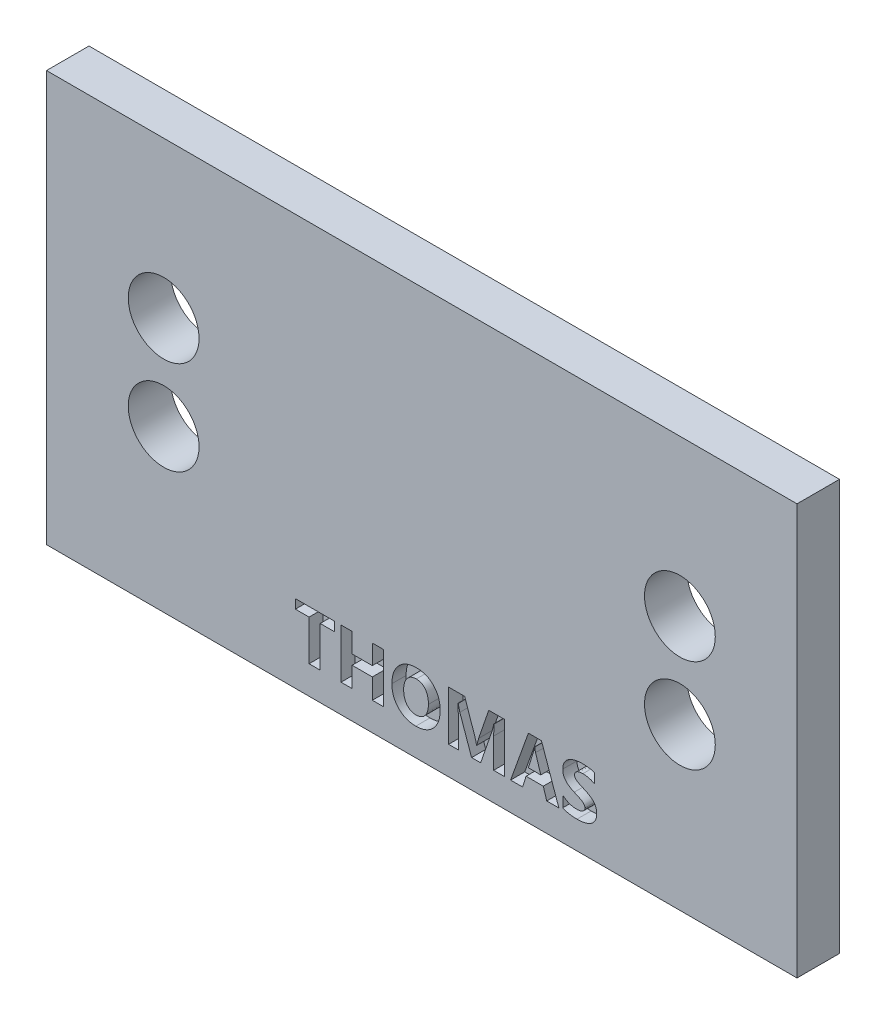
from build123d import *

# Parameters (mm, degrees)
SKETCH1_W           = 53
SKETCH1_H           = 29
SKETCH1_R           = 2.5
BOSS_EXTRUDE1_DEPTH = 3
CUT_EXTRUDE1_DEPTH  = 1


with BuildPart() as part:
    # Sketch1 → Boss-Extrude1 (new body)
    with BuildSketch(Plane.XY):
        with Locations((0.842105263, 3.907894737)):
            Rectangle(SKETCH1_W, SKETCH1_H)
        with Locations((-17.386708014, 0.781282568)):
            Circle(SKETCH1_R, mode=Mode.SUBTRACT)
        with Locations((19.07091854, 0.781282568)):
            Circle(SKETCH1_R, mode=Mode.SUBTRACT)
        with Locations((19.07091854, 7.39994378)):
            Circle(SKETCH1_R, mode=Mode.SUBTRACT)
        with Locations((-17.386708014, 7.39994378)):
            Circle(SKETCH1_R, mode=Mode.SUBTRACT)
    extrude(amount=BOSS_EXTRUDE1_DEPTH)

    # Sketch2 → Cut-Extrude1 (cut)
    # profile 1 of 6: a face of its own
    with BuildSketch(Plane.XY.offset(3)):
        Polygon((-5.319115808, -5.746417775), (-6.332273703, -5.746417775), (-6.332273703, -8.601680933), (-7.115168439, -8.601680933), (-7.115168439, -5.746417775), (-8.082273703, -5.746417775), (-8.082273703, -5.101680933), (-5.319115808, -5.101680933), align=None)
    # profile 2 of 6: a face of its own
    with BuildSketch(Plane.XY.offset(3)):
        Polygon((-1.865168439, -8.601680933), (-2.648063176, -8.601680933), (-2.648063176, -7.174049354), (-4.075694755, -7.174049354), (-4.075694755, -8.601680933), (-4.858589492, -8.601680933), (-4.858589492, -5.101680933), (-4.075694755, -5.101680933), (-4.075694755, -6.483259881), (-2.648063176, -6.483259881), (-2.648063176, -5.101680933), (-1.865168439, -5.101680933), align=None)
    # profile 3 of 6: a face of its own
    with BuildSketch(Plane.XY.offset(3)):
        with BuildLine():
            add(Edge.make_bspline(
                [(0.421632547, -8.647733565), (0.360886152, -8.646127526), (0.241615003, -8.642974184), (0.067023663, -8.620745981), (-0.098949007, -8.582301478), (-0.256377446, -8.529321102), (-0.405020681, -8.460194729), (-0.545247851, -8.376740139), (-0.676208606, -8.276960612), (-0.798044084, -8.164008411), (-0.907900315, -8.038259144), (-1.004077569, -7.902268276), (-1.085969089, -7.757357636), (-1.151419799, -7.602330998), (-1.203551471, -7.438874393), (-1.239637133, -7.265978025), (-1.26284714, -7.084255757), (-1.265252857, -6.95993058), (-1.266484229, -6.89629442)],
                knots=[0, 0, 0, 0, 1.066514654, 2.094024304, 3.083949431, 4.053508208, 5.005063613, 5.95701037, 6.91302883, 7.890458477, 8.869429341, 9.839289914, 10.810402398, 11.785888464, 12.788834388, 13.818042923, 14.883159698, 16, 16, 16, 16], degree=3))
            add(Edge.make_bspline(
                [(-1.266484229, -6.89629442), (-1.265325425, -6.829294159), (-1.263054559, -6.697996229), (-1.238720902, -6.506349998), (-1.203234551, -6.323909151), (-1.150022465, -6.15209708), (-1.083310731, -5.989423165), (-0.999864157, -5.837568223), (-0.903071333, -5.694259458), (-0.790980552, -5.562694929), (-0.667252401, -5.443270124), (-0.532090204, -5.339656641), (-0.38788856, -5.251214118), (-0.233083452, -5.179911813), (-0.069288599, -5.123321995), (0.104722888, -5.084224051), (0.288060636, -5.059912521), (0.413639198, -5.05707641), (0.477759192, -5.055628302)],
                knots=[0, 0, 0, 0, 1.12554662, 2.205692039, 3.242259702, 4.245908483, 5.223734231, 6.19255057, 7.153102442, 8.125652901, 9.092277335, 10.038164733, 10.982667815, 11.929628597, 12.897328609, 13.890001992, 14.922642057, 16, 16, 16, 16], degree=3))
            add(Edge.make_bspline(
                [(0.477759192, -5.055628302), (0.538269248, -5.057216206), (0.656831398, -5.060327513), (0.830427184, -5.082742396), (0.995095439, -5.120772594), (1.150889799, -5.174309003), (1.298085862, -5.24282753), (1.435771908, -5.327589542), (1.565095128, -5.426877476), (1.683815932, -5.541169482), (1.79147857, -5.667347075), (1.885962133, -5.803966703), (1.964218773, -5.951179804), (2.029558094, -6.10737389), (2.0797323, -6.273567252), (2.115518035, -6.449388484), (2.137499734, -6.634771144), (2.140088254, -6.761672743), (2.141410508, -6.8264959)],
                knots=[0, 0, 0, 0, 1.061845288, 2.080557679, 3.065951617, 4.023138676, 4.966648067, 5.909556233, 6.855120048, 7.822765862, 8.796245348, 9.761911246, 10.731870988, 11.716932167, 12.729003832, 13.77338215, 14.862611647, 16, 16, 16, 16], degree=3))
            add(Edge.make_bspline(
                [(2.141410508, -6.8264959), (2.140142413, -6.893001666), (2.137658224, -7.023285932), (2.114870103, -7.213733719), (2.077851157, -7.394467134), (2.025095928, -7.56501616), (1.9579965, -7.725946031), (1.875759037, -7.877081055), (1.777966564, -8.017908424), (1.666755644, -8.148058321), (1.543174421, -8.264843295), (1.410313979, -8.368014672), (1.267631946, -8.454860079), (1.115761844, -8.525528375), (0.954886186, -8.58063197), (0.785009001, -8.618851953), (0.606324556, -8.643520095), (0.484079455, -8.646308933), (0.421632547, -8.647733565)],
                knots=[0, 0, 0, 0, 1.132328248, 2.218222035, 3.261372295, 4.2705407, 5.253810636, 6.226363414, 7.195245697, 8.168733222, 9.136779753, 10.086262421, 11.028590864, 11.97529237, 12.933871248, 13.918904746, 14.936906574, 16, 16, 16, 16], degree=3))
        make_face()
        with BuildLine():
            add(Edge.make_bspline(
                [(0.455452449, -5.746417775), (0.422064183, -5.747452175), (0.356920275, -5.749470394), (0.261572057, -5.763315939), (0.171466628, -5.786520301), (0.087247935, -5.821425143), (0.007345116, -5.863382568), (-0.066363932, -5.916811102), (-0.135107556, -5.979082306), (-0.198204234, -6.050336465), (-0.254988103, -6.129346672), (-0.303951614, -6.215307194), (-0.34493723, -6.307276197), (-0.378990039, -6.405210374), (-0.405526058, -6.509437185), (-0.423775455, -6.619949033), (-0.435826853, -6.736282209), (-0.436957455, -6.815910426), (-0.43753686, -6.85671794)],
                knots=[0, 0, 0, 0, 0.999383284, 1.949898576, 2.878239443, 3.77697613, 4.673299942, 5.573985174, 6.494153057, 7.445291985, 8.417767725, 9.401943952, 10.401533592, 11.427998165, 12.502564195, 13.616962893, 14.77875175, 16, 16, 16, 16], degree=3))
            add(Edge.make_bspline(
                [(-0.43753686, -6.85671794), (-0.436953094, -6.898004561), (-0.435813684, -6.9785889), (-0.423862422, -7.095889582), (-0.405654467, -7.206673861), (-0.378708683, -7.310779085), (-0.345207156, -7.408651303), (-0.304299466, -7.500036935), (-0.254721498, -7.584215045), (-0.198442789, -7.661483716), (-0.135555699, -7.730763847), (-0.068156207, -7.791590067), (0.00480235, -7.84242681), (0.081949811, -7.884386705), (0.163844829, -7.917040734), (0.250364661, -7.939802499), (0.341463542, -7.955014474), (0.404059043, -7.956291809), (0.436023995, -7.956944091)],
                knots=[0, 0, 0, 0, 1.254202876, 2.447986969, 3.579160536, 4.662840844, 5.711642924, 6.719633901, 7.699699477, 8.675010393, 9.619324756, 10.538175985, 11.427887183, 12.314997099, 13.201537904, 14.09971778, 15.029603896, 16, 16, 16, 16], degree=3))
            add(Edge.make_bspline(
                [(0.436023995, -7.956944091), (0.468939859, -7.956237155), (0.533153868, -7.954858026), (0.626652303, -7.940536405), (0.715135639, -7.918619707), (0.798130875, -7.886723495), (0.876074621, -7.846194463), (0.94825222, -7.796022839), (1.015752954, -7.737320763), (1.07746634, -7.669654808), (1.132650016, -7.593988543), (1.181454741, -7.511576925), (1.221356344, -7.421438999), (1.255531008, -7.324902753), (1.281231486, -7.221001548), (1.298611905, -7.110220953), (1.310788926, -6.992985982), (1.311895961, -6.912397917), (1.31246314, -6.871109387)],
                knots=[0, 0, 0, 0, 1.00217265, 1.955091423, 2.875015528, 3.774864866, 4.657455052, 5.545354462, 6.446656772, 7.377747269, 8.329319954, 9.295679398, 10.29001399, 11.327793258, 12.4125512, 13.545522493, 14.742471758, 16, 16, 16, 16], degree=3))
            add(Edge.make_bspline(
                [(1.31246314, -6.871109387), (1.311821143, -6.827910676), (1.310574248, -6.74400943), (1.299523097, -6.621661875), (1.281883263, -6.50668607), (1.256969631, -6.399011902), (1.224082905, -6.29911971), (1.185941478, -6.205792911), (1.138690647, -6.120363106), (1.084612061, -6.042765167), (1.025429128, -5.972427702), (0.959065827, -5.91250202), (0.888403793, -5.860870146), (0.81206299, -5.818700326), (0.730292836, -5.786223097), (0.643259095, -5.76357151), (0.551211336, -5.748306973), (0.487897742, -5.747057879), (0.455452449, -5.746417775)],
                knots=[0, 0, 0, 0, 1.299402741, 2.523721339, 3.692309641, 4.796776925, 5.844208707, 6.853356801, 7.825499763, 8.774330453, 9.695566542, 10.584351255, 11.457621121, 12.323224798, 13.200925798, 14.09712034, 15.024862037, 16, 16, 16, 16], degree=3))
        make_face(mode=Mode.SUBTRACT)
    # profile 4 of 6: a face of its own
    with BuildSketch(Plane.XY.offset(3)):
        with BuildLine():
            Line((6.700621034, -8.601680933), (5.917726297, -8.601680933))
            Line((5.917726297, -8.601680933), (5.917726297, -6.507725341))
            add(Edge.make_bspline(
                [(5.917726297, -6.507725341), (5.918287461, -6.449677669), (5.919440111, -6.330445721), (5.92428941, -6.1473802), (5.933894902, -5.955480096), (5.942712734, -5.824838631), (5.947228765, -5.757930933)],
                knots=[0, 0, 0, 0, 0.928152517, 1.906457722, 2.927797591, 4, 4, 4, 4], degree=3))
            Line((5.947228765, -5.757930933), (5.927800311, -5.757930933))
            add(Edge.make_bspline(
                [(5.927800311, -5.757930933), (5.9227762, -5.783837815), (5.913095225, -5.833757864), (5.898862283, -5.906040397), (5.884412116, -5.97242132), (5.870876816, -6.033439534), (5.857055874, -6.088517926), (5.844415518, -6.138326531), (5.831399559, -6.182155536), (5.822553734, -6.209359011), (5.818425311, -6.222055111)],
                knots=[0, 0, 0, 0, 1.327313991, 2.557605269, 3.705207991, 4.744183751, 5.700973686, 6.5612476, 7.3285217, 8, 8, 8, 8], degree=3))
            Line((5.818425311, -6.222055111), (5.002430245, -8.601680933))
            Line((5.002430245, -8.601680933), (4.361291265, -8.601680933))
            Line((4.361291265, -8.601680933), (3.530904751, -6.246520571))
            add(Edge.make_bspline(
                [(3.530904751, -6.246520571), (3.527655467, -6.237205528), (3.520073404, -6.215469279), (3.510837371, -6.177472354), (3.498939143, -6.13032279), (3.486363864, -6.073858235), (3.471836353, -6.008168482), (3.456026026, -5.933085477), (3.438747313, -5.84870207), (3.427447233, -5.78912795), (3.421529751, -5.757930933)],
                knots=[0, 0, 0, 0, 0.472413095, 1.102355455, 1.871602873, 2.802702045, 3.873391322, 5.094959742, 6.47872549, 8, 8, 8, 8], degree=3))
            Line((3.421529751, -5.757930933), (3.39994258, -5.757930933))
            add(Edge.make_bspline(
                [(3.39994258, -5.757930933), (3.404775677, -5.841627693), (3.414120265, -6.003451825), (3.423194233, -6.238557279), (3.429362788, -6.457562642), (3.43039053, -6.598387737), (3.430884192, -6.666031262)],
                knots=[0, 0, 0, 0, 1.107032083, 2.140399523, 3.106764814, 4, 4, 4, 4], degree=3))
            Line((3.430884192, -6.666031262), (3.430884192, -8.601680933))
            Line((3.430884192, -8.601680933), (2.740094719, -8.601680933))
            Line((2.740094719, -8.601680933), (2.740094719, -5.101680933))
            Line((2.740094719, -5.101680933), (3.872701626, -5.101680933))
            Line((3.872701626, -5.101680933), (4.584358699, -7.176208071))
            add(Edge.make_bspline(
                [(4.584358699, -7.176208071), (4.59794709, -7.217583957), (4.625026831, -7.300040243), (4.658406474, -7.42526433), (4.686940623, -7.550502509), (4.701084581, -7.634499123), (4.708125146, -7.676310867)],
                knots=[0, 0, 0, 0, 1.012979573, 2.018724972, 3.013763031, 4, 4, 4, 4], degree=3))
            Line((4.708125146, -7.676310867), (4.722516594, -7.676310867))
            add(Edge.make_bspline(
                [(4.722516594, -7.676310867), (4.733248885, -7.629463461), (4.754063758, -7.538604695), (4.789224366, -7.407898795), (4.822925238, -7.285860951), (4.848388093, -7.208499628), (4.860674488, -7.171171065)],
                knots=[0, 0, 0, 0, 1.100720075, 2.134804773, 3.100001708, 4, 4, 4, 4], degree=3))
            Line((4.860674488, -7.171171065), (5.572331561, -5.101680933))
            Line((5.572331561, -5.101680933), (6.700621034, -5.101680933))
            Line((6.700621034, -5.101680933), (6.700621034, -8.601680933))
        make_face()
    # profile 5 of 6: a face of its own
    with BuildSketch(Plane.XY.offset(3)):
        Polygon((10.522989455, -8.601680933), (9.668137482, -8.601680933), (9.422763304, -7.818786196), (8.208125146, -7.818786196), (7.964909686, -8.601680933), (7.115094719, -8.601680933), (8.372187646, -5.101680933), (9.294679422, -5.101680933), align=None)
        with BuildLine():
            Line((9.247187646, -7.220101986), (8.878766594, -6.040003302))
            add(Edge.make_bspline(
                [(8.878766594, -6.040003302), (8.871868228, -6.017079625), (8.857562736, -5.969541629), (8.843803031, -5.893644008), (8.829791554, -5.812276193), (8.825077938, -5.755589436), (8.822639949, -5.726269749)],
                knots=[0, 0, 0, 0, 0.898789601, 1.86386582, 2.895142575, 4, 4, 4, 4], degree=3))
            Line((8.822639949, -5.726269749), (8.803211495, -5.726269749))
            add(Edge.make_bspline(
                [(8.803211495, -5.726269749), (8.798160806, -5.777453951), (8.787970687, -5.880721662), (8.757444072, -5.979905499), (8.742047844, -6.029929288)],
                knots=[0, 0, 0, 0, 0.991291496, 2, 2, 2, 2], degree=3))
            Line((8.742047844, -6.029929288), (8.369309357, -7.220101986))
            Line((8.369309357, -7.220101986), (9.247187646, -7.220101986))
        make_face(mode=Mode.SUBTRACT)
    # profile 6 of 6: a face of its own
    with BuildSketch(Plane.XY.offset(3)):
        with BuildLine():
            Line((10.799305245, -8.454168598), (10.799305245, -7.680628302))
            add(Edge.make_bspline(
                [(10.799305245, -7.680628302), (10.835254147, -7.710090359), (10.906315975, -7.768329345), (11.020802066, -7.843050827), (11.139296997, -7.907075338), (11.262177298, -7.958436851), (11.387583189, -7.999015222), (11.514042702, -8.02751629), (11.6411523, -8.045784005), (11.726053512, -8.047959792), (11.768569225, -8.049049354)],
                knots=[0, 0, 0, 0, 1.052804814, 2.08112707, 3.092934838, 4.101597725, 5.095309197, 6.076510114, 7.036780032, 8, 8, 8, 8], degree=3))
            add(Edge.make_bspline(
                [(11.768569225, -8.049049354), (11.792811538, -8.048938058), (11.839693129, -8.048722825), (11.90737852, -8.042419102), (11.970428757, -8.034242006), (12.028770874, -8.021807694), (12.082722755, -8.006985994), (12.132066584, -7.988924486), (12.17656773, -7.968150864), (12.216745139, -7.945060089), (12.251969742, -7.919226472), (12.28256561, -7.89111391), (12.307982557, -7.860459599), (12.335887632, -7.817499899), (12.359585125, -7.757430636), (12.363254173, -7.706764226), (12.365094719, -7.681347874)],
                knots=[0, 0, 0, 0, 1.302764252, 2.519382516, 3.651968008, 4.719312502, 5.723721354, 6.658045591, 7.540747622, 8.361350842, 9.145473591, 9.884614119, 10.589667965, 11.280062621, 12.635567738, 14, 14, 14, 14], degree=3))
            add(Edge.make_bspline(
                [(12.365094719, -7.681347874), (12.364417542, -7.664742817), (12.363087393, -7.632126186), (12.352115765, -7.584539039), (12.332957331, -7.540359258), (12.30716004, -7.498713246), (12.275162062, -7.459191022), (12.237757674, -7.421183934), (12.194811989, -7.384917317), (12.128489159, -7.338074736), (12.033210158, -7.28124142), (11.90381642, -7.219004133), (11.760679439, -7.155530402), (11.660489484, -7.114101481), (11.608824159, -7.092737677)],
                knots=[0, 0, 0, 0, 0.590934481, 1.160748317, 1.727158715, 2.298507061, 2.900148301, 3.534378593, 4.194980596, 4.898998642, 6.423979724, 8.139194984, 10.009084388, 12, 12, 12, 12], degree=3))
            add(Edge.make_bspline(
                [(11.608824159, -7.092737677), (11.5758166, -7.078424615), (11.511310991, -7.050453061), (11.419031093, -7.004008085), (11.332761188, -6.956269331), (11.253082137, -6.90576104), (11.180349359, -6.852493837), (11.113926323, -6.796806075), (11.053280305, -6.739638214), (10.999569362, -6.679472511), (10.952420136, -6.616366871), (10.911352883, -6.550227959), (10.87661781, -6.480872293), (10.848514887, -6.408277264), (10.826092208, -6.332759268), (10.810320612, -6.253774355), (10.800750757, -6.171684358), (10.799791654, -6.115824422), (10.799305245, -6.087495078)],
                knots=[0, 0, 0, 0, 1.250860862, 2.444517047, 3.590871071, 4.678394788, 5.722744029, 6.723411862, 7.690959296, 8.618453783, 9.5242799, 10.426990097, 11.322232235, 12.217513229, 13.130682761, 14.058177248, 15.015205389, 16, 16, 16, 16], degree=3))
            add(Edge.make_bspline(
                [(10.799305245, -6.087495078), (10.800735415, -6.043765799), (10.803509678, -5.958939209), (10.82350585, -5.836423324), (10.858095788, -5.723528186), (10.907115186, -5.62071198), (10.966833325, -5.526448717), (11.038465305, -5.442091933), (11.118300494, -5.364901529), (11.209297596, -5.298319391), (11.30797117, -5.239095094), (11.414874686, -5.18881487), (11.52915164, -5.14720945), (11.650194389, -5.113453451), (11.77682066, -5.088181095), (11.907726835, -5.069423442), (12.042023782, -5.057477892), (12.132887775, -5.056248491), (12.178725475, -5.055628302)],
                knots=[0, 0, 0, 0, 1.081198718, 2.097322509, 3.059813659, 3.991166944, 4.906054364, 5.811353855, 6.721769168, 7.6459357, 8.59302305, 9.564157515, 10.562518314, 11.597307653, 12.668715501, 13.753374479, 14.866656162, 16, 16, 16, 16], degree=3))
            add(Edge.make_bspline(
                [(12.178725475, -5.055628302), (12.223104381, -5.056088486), (12.309262047, -5.056981894), (12.434811914, -5.06256157), (12.552411527, -5.072635647), (12.66312092, -5.086236352), (12.7678501, -5.104153903), (12.867834894, -5.126784759), (12.964063419, -5.151904347), (13.025556534, -5.173688216), (13.055884192, -5.184431756)],
                knots=[0, 0, 0, 0, 1.195237994, 2.320447403, 3.383723621, 4.373269299, 5.323774543, 6.243759987, 7.133843727, 8, 8, 8, 8], degree=3))
            Line((13.055884192, -5.184431756), (13.055884192, -5.88457567))
            add(Edge.make_bspline(
                [(13.055884192, -5.88457567), (13.025511673, -5.865982443), (12.963451667, -5.827991), (12.862922907, -5.781773968), (12.757500782, -5.741208029), (12.648504988, -5.709548615), (12.538555344, -5.683931109), (12.429533972, -5.667259292), (12.323567136, -5.656683451), (12.254303655, -5.655090733), (12.220460672, -5.654312512)],
                knots=[0, 0, 0, 0, 0.973185875, 1.988505531, 3.020409709, 4.060289755, 5.089876897, 6.105810916, 7.074476093, 8, 8, 8, 8], degree=3))
            add(Edge.make_bspline(
                [(12.220460672, -5.654312512), (12.17743276, -5.655365435), (12.094699275, -5.657389981), (11.977985535, -5.677803808), (11.875300537, -5.708511376), (11.789011341, -5.751613078), (11.719591105, -5.805392838), (11.675661813, -5.858898296), (11.65112571, -5.905779752), (11.63826903, -5.942643334), (11.629905012, -5.981588628), (11.62881326, -6.008297973), (11.628252613, -6.022013992)],
                knots=[0, 0, 0, 0, 1.666493883, 3.204311803, 4.577720999, 5.808610471, 6.920989002, 7.959277989, 8.462502887, 8.965384053, 9.468694847, 10, 10, 10, 10], degree=3))
            add(Edge.make_bspline(
                [(11.628252613, -6.022013992), (11.628791684, -6.036208445), (11.629852831, -6.064149893), (11.638647165, -6.104727681), (11.653442842, -6.14293784), (11.681086546, -6.192136728), (11.731612464, -6.249324662), (11.807576067, -6.314143224), (11.903878562, -6.373782539), (12.01631052, -6.434395677), (12.146477849, -6.493097547), (12.238841219, -6.531930803), (12.287380903, -6.552338828)],
                knots=[0, 0, 0, 0, 0.477042346, 0.939046667, 1.388484856, 1.850770801, 2.82993316, 3.934162149, 5.200672571, 6.629956823, 8.228942609, 10, 10, 10, 10], degree=3))
            add(Edge.make_bspline(
                [(12.287380903, -6.552338828), (12.321336422, -6.566670913), (12.388113558, -6.59485648), (12.484106815, -6.641462605), (12.575946652, -6.687529474), (12.66143105, -6.737062832), (12.74268481, -6.786615289), (12.816783997, -6.841093434), (12.885600298, -6.897922345), (12.948438901, -6.958303028), (13.004604705, -7.022665915), (13.055452505, -7.090389724), (13.096395343, -7.164335669), (13.132460136, -7.241929082), (13.16081454, -7.325021297), (13.179677865, -7.414673374), (13.192553342, -7.510435036), (13.19353634, -7.57672431), (13.194042087, -7.610829782)],
                knots=[0, 0, 0, 0, 1.182142093, 2.324808002, 3.422600261, 4.4772321, 5.493523657, 6.473934373, 7.424665926, 8.355223432, 9.265842699, 10.163099642, 11.065981044, 11.971547163, 12.905946225, 13.874936649, 14.906666431, 16, 16, 16, 16], degree=3))
            add(Edge.make_bspline(
                [(13.194042087, -7.610829782), (13.192718, -7.657447597), (13.190164644, -7.747344953), (13.169103125, -7.87617844), (13.134898181, -7.993863553), (13.085529172, -8.099403179), (13.023971132, -8.194148647), (12.952725721, -8.279288423), (12.871018562, -8.354870634), (12.780117104, -8.42109933), (12.680163487, -8.477889404), (12.572608425, -8.526020792), (12.457310463, -8.565906779), (12.334811781, -8.596108843), (12.206587392, -8.618800774), (12.074480749, -8.63518219), (11.938793446, -8.645576882), (11.847261148, -8.647008986), (11.800949982, -8.647733565)],
                knots=[0, 0, 0, 0, 1.135948082, 2.190551571, 3.17297232, 4.114787176, 5.019868708, 5.920575964, 6.814327848, 7.726634493, 8.65648264, 9.611815768, 10.59564518, 11.626721736, 12.684287895, 13.768626863, 14.871027011, 16, 16, 16, 16], degree=3))
            add(Edge.make_bspline(
                [(11.800949982, -8.647733565), (11.753201397, -8.647265059), (11.659048324, -8.646341235), (11.519569756, -8.636468814), (11.383683544, -8.621481755), (11.251931905, -8.601149822), (11.126527068, -8.573897286), (11.009009156, -8.54123764), (10.900224047, -8.501752698), (10.832427227, -8.469785903), (10.799305245, -8.454168598)],
                knots=[0, 0, 0, 0, 1.113719809, 2.196089038, 3.260137412, 4.302409517, 5.30443291, 6.252114794, 7.146074671, 8, 8, 8, 8], degree=3))
        make_face()
    extrude(amount=-CUT_EXTRUDE1_DEPTH, mode=Mode.SUBTRACT)


solid = part.part
